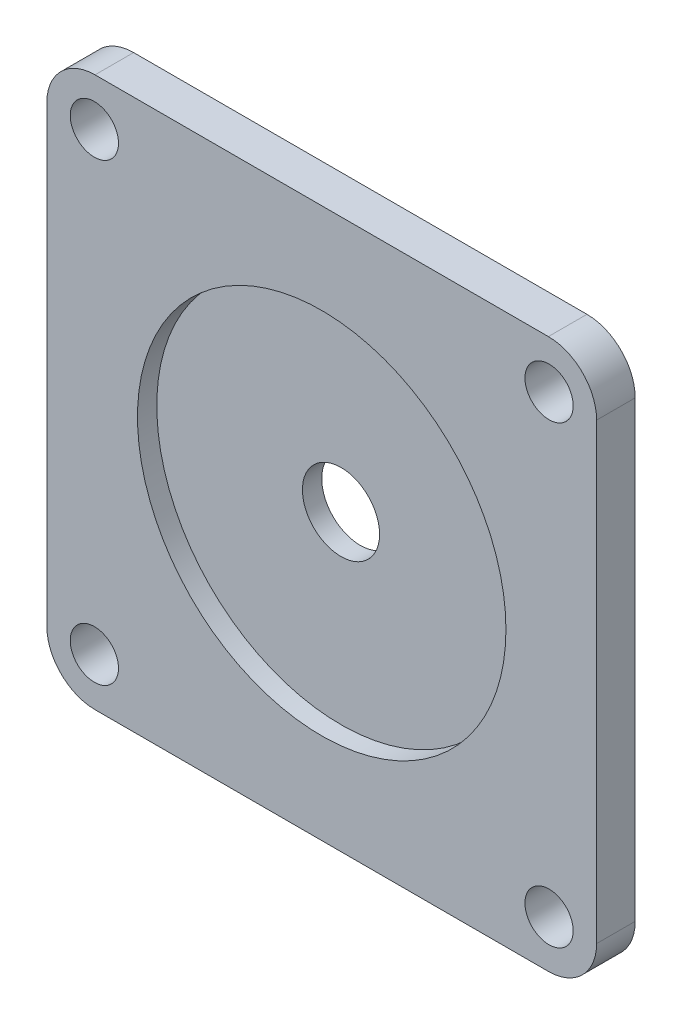
from build123d import *

# Parameters (mm, degrees)
SKIZZE1_W                       = 57
SKIZZE1_H                       = 57
AUFSATZ_LINEAR_AUSTRAGEN1_DEPTH = 4
F_5_0_5_DURCHMESSER_BOHRUNG2_D  = 5
VERRUNDUNG1_R                   = 5
SKIZZE6_R                       = 19.1
SCHNITT_LINEAR_AUSTRAGEN1_DEPTH = 2
F_8_0_8_DURCHMESSER_BOHRUNG1_D  = 8


with BuildPart() as part:
    # Skizze1 → Aufsatz-Linear austragen1 (new body)
    with BuildSketch(Plane.XY):
        Rectangle(SKIZZE1_W, SKIZZE1_H)
    extrude(amount=AUFSATZ_LINEAR_AUSTRAGEN1_DEPTH)

    # Ø5.0 (5) Durchmesser Bohrung2 (through all)
    with Locations(Plane.XY.offset(4)):
        with Locations((-23.57, 23.57), (23.57, 23.57), (23.57, -23.57), (-23.57, -23.57)):
            Hole(F_5_0_5_DURCHMESSER_BOHRUNG2_D / 2)

    # Verrundung1
    verrundung1_edges = [part.edges().sort_by_distance(p)[0] for p in [
        (28.5, -28.5, 2),
        (-28.5, -28.5, 2),
        (-28.5, 28.5, 2),
        (28.5, 28.5, 2),
    ]]
    fillet(verrundung1_edges, radius=VERRUNDUNG1_R)

    # Skizze6 → Schnitt-Linear austragen1 (cut)
    with BuildSketch(Plane.XY.offset(4)):
        Circle(SKIZZE6_R)
    extrude(amount=-SCHNITT_LINEAR_AUSTRAGEN1_DEPTH, mode=Mode.SUBTRACT)

    # Ø8.0 (8) Durchmesser Bohrung1 (through all)
    with Locations(Plane.XY.offset(2)):
        with Locations((0, 0)):
            Hole(F_8_0_8_DURCHMESSER_BOHRUNG1_D / 2)


solid = part.part
